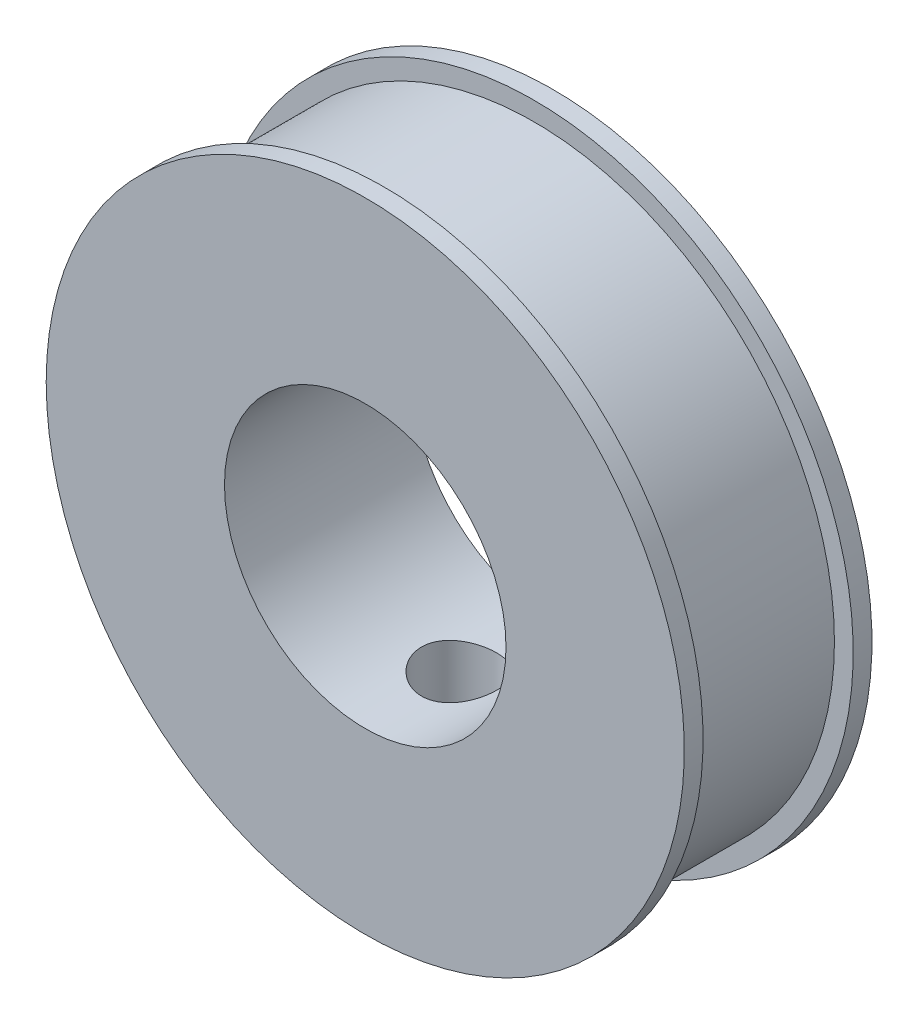
from build123d import *

# Parameters (mm, degrees)
SKETCH2_R          = 7.5
CUT_EXTRUDE1_DEPTH = 27.038433133
SKETCH3_R          = 2
CUT_EXTRUDE2_DEPTH = 27


with BuildPart() as part:
    # Sketch1 → Revolve1 (revolve)
    with BuildSketch(Plane(origin=(0, 0, 0), x_dir=(1, 0, 0), z_dir=(0, 1, 0)), mode=Mode.PRIVATE) as revolve1_sk:
        Polygon((0, 0), (17, 0), (17, 1), (16, 1), (16, 9), (17, 9), (17, 10), (0, 10), align=None)
    revolve(revolve1_sk.sketch.rotate(Axis((0, 0, -10), (0, 0, 1)), 180), axis=Axis((0, 0, -10), (0, 0, 1)))

    # Sketch2 → Cut-Extrude1 (cut, through all)
    with BuildSketch(Plane(origin=(0, 0, -10), x_dir=(-1, 0, 0), z_dir=(0, 0, -1))):
        Circle(SKETCH2_R)
    extrude(amount=-CUT_EXTRUDE1_DEPTH, mode=Mode.SUBTRACT)

    # Sketch3 → Cut-Extrude2 (cut)
    with BuildSketch(Plane(origin=(0, 0, 0), x_dir=(1, 0, 0), z_dir=(0, 1, 0))):
        with Locations(Location((0, 5, 0), (0, 0, 270))):
            Circle(SKETCH3_R)
    extrude(amount=-CUT_EXTRUDE2_DEPTH, mode=Mode.SUBTRACT)


solid = part.part
